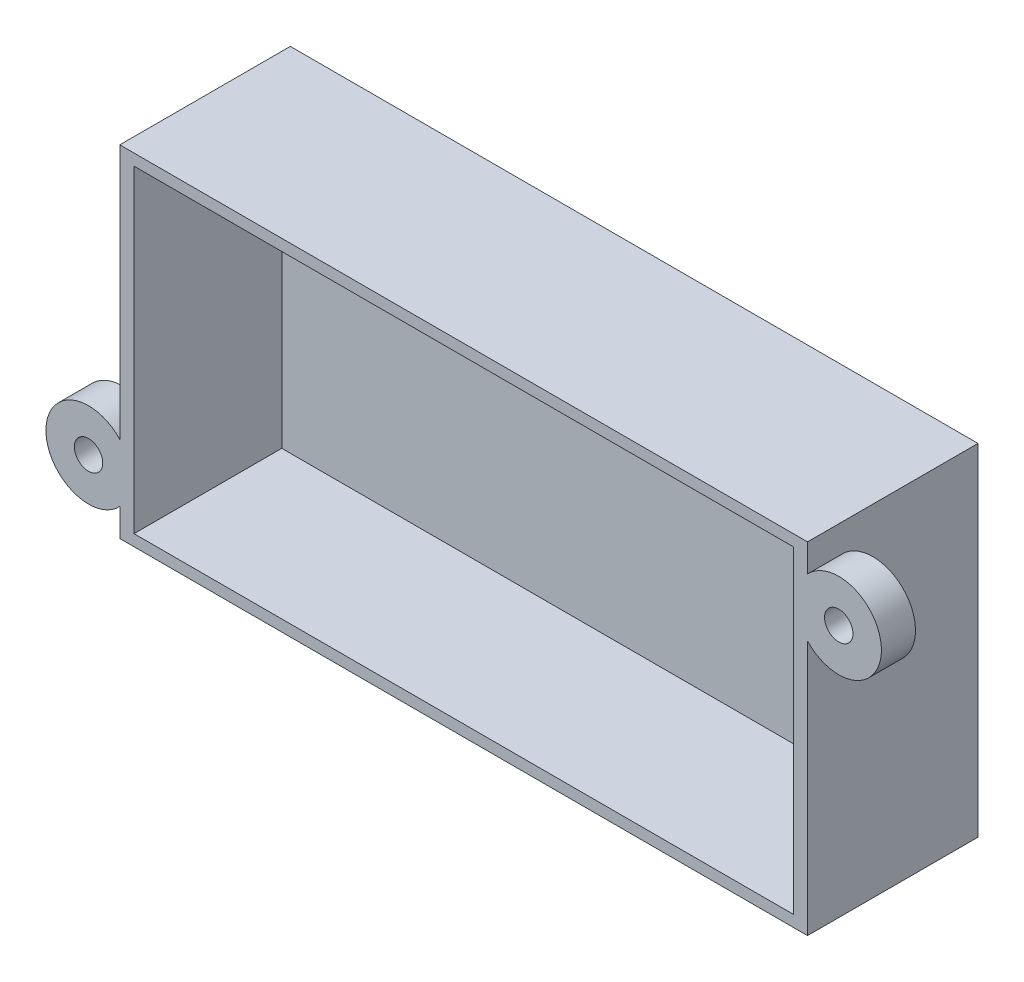
from build123d import *

# Parameters (mm, degrees)
SKIZZE1_W                       = 60.5
SKIZZE1_H                       = 30
AUFSATZ_LINEAR_AUSTRAGEN1_DEPTH = 15
SKIZZE2_W                       = 58
SKIZZE2_H                       = 28
SKIZZE2_R                       = 1.25
SCHNITT_LINEAR_AUSTRAGEN2_DEPTH = 13
SKIZZE2_5_R                     = 1.25
AUFSATZ_LINEAR_AUSTRAGEN2_DEPTH = 3


with BuildPart() as part:
    # Skizze1 → Aufsatz-Linear austragen1 (new body)
    with BuildSketch(Plane.XY):
        Rectangle(SKIZZE1_W, SKIZZE1_H)
    extrude(amount=AUFSATZ_LINEAR_AUSTRAGEN1_DEPTH)

    # Skizze2 → Schnitt-Linear austragen2 (cut)
    # profile 1 of 3: a face of its own
    with BuildSketch(Plane.XY.offset(15)):
        Rectangle(SKIZZE2_W, SKIZZE2_H)
    # profile 2 of 3: a face of its own
    with BuildSketch(Plane.XY.offset(15)):
        with BuildLine():
            Line((-30.25, -7.450490243), (-30.25, -12.549509757))
            ThreePointArc((-30.25, -12.549509757), (-36.75, -10), (-30.25, -7.450490243))
        make_face()
        with Locations((-33, -10)):
            Circle(SKIZZE2_R, mode=Mode.SUBTRACT)
    # profile 3 of 3: a face of its own
    with BuildSketch(Plane.XY.offset(15)):
        with BuildLine():
            Line((30.25, 12.549509757), (30.25, 7.450490243))
            ThreePointArc((30.25, 7.450490243), (36.75, 10), (30.25, 12.549509757))
        make_face()
        with Locations((33, 10)):
            Circle(SKIZZE2_R, mode=Mode.SUBTRACT)
    extrude(amount=-SCHNITT_LINEAR_AUSTRAGEN2_DEPTH, mode=Mode.SUBTRACT)

    # Skizze2<5> → Aufsatz-Linear austragen2 (add)
    # profile 1 of 2: a face of its own
    with BuildSketch(Plane.XY.offset(15)):
        with BuildLine():
            Line((-30.25, -12.549509757), (-30.25, -7.450490243))
            ThreePointArc((-30.25, -7.450490243), (-36.75, -10), (-30.25, -12.549509757))
        make_face()
        with Locations((-33, -10)):
            Circle(SKIZZE2_5_R, mode=Mode.SUBTRACT)
    # profile 2 of 2: a face of its own
    with BuildSketch(Plane.XY.offset(15)):
        with BuildLine():
            ThreePointArc((30.25, 7.450490243), (36.75, 10), (30.25, 12.549509757))
            Line((30.25, 12.549509757), (30.25, 7.450490243))
        make_face()
        with Locations((33, 10)):
            Circle(SKIZZE2_5_R, mode=Mode.SUBTRACT)
    extrude(amount=-AUFSATZ_LINEAR_AUSTRAGEN2_DEPTH)


solid = part.part
